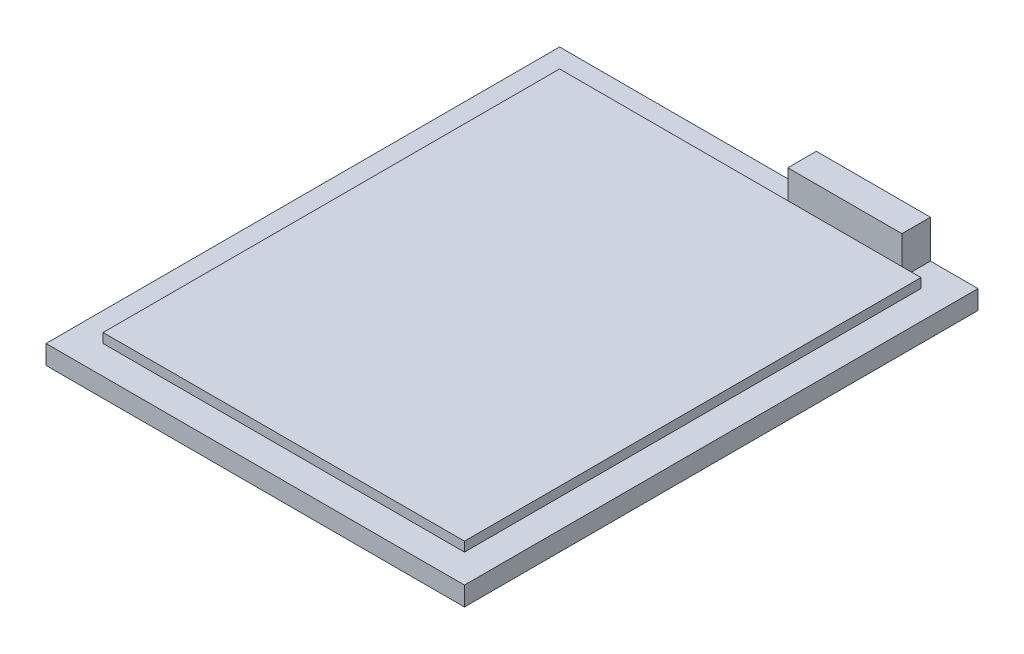
from build123d import *

# Parameters (mm, degrees)
SCHIZZO1_W                   = 44
SCHIZZO1_H                   = 54
ESTRUSIONE_ESTRUSIONE1_DEPTH = 2
SCHIZZO2_W                   = 38
SCHIZZO2_H                   = 48
ESTRUSIONE_ESTRUSIONE2_DEPTH = 1
SCHIZZO3_W                   = 12
SCHIZZO3_H                   = 3
ESTRUSIONE_ESTRUSIONE3_DEPTH = 4


with BuildPart() as part:
    # Schizzo1 → Estrusione-Estrusione1 (new body)
    with BuildSketch(Plane(origin=(0, 0, 0), x_dir=(1, 0, 0), z_dir=(0, 1, 0))):
        with Locations((9.928073705, -8.029830108)):
            Rectangle(SCHIZZO1_W, SCHIZZO1_H)
    extrude(amount=ESTRUSIONE_ESTRUSIONE1_DEPTH)

    # Schizzo2 → Estrusione-Estrusione2 (add)
    with BuildSketch(Plane(origin=(0, 2, 0), x_dir=(1, 0, 0), z_dir=(0, 1, 0))):
        with Locations((9.928073705, -8.029830108)):
            Rectangle(SCHIZZO2_W, SCHIZZO2_H)
    extrude(amount=ESTRUSIONE_ESTRUSIONE2_DEPTH)

    # Schizzo3 → Estrusione-Estrusione3 (add)
    with BuildSketch(Plane(origin=(0, 2, 0), x_dir=(1, 0, 0), z_dir=(0, 1, 0))):
        with Locations((20.928073705, 17.470169892)):
            Rectangle(SCHIZZO3_W, SCHIZZO3_H)
    extrude(amount=ESTRUSIONE_ESTRUSIONE3_DEPTH)


solid = part.part
